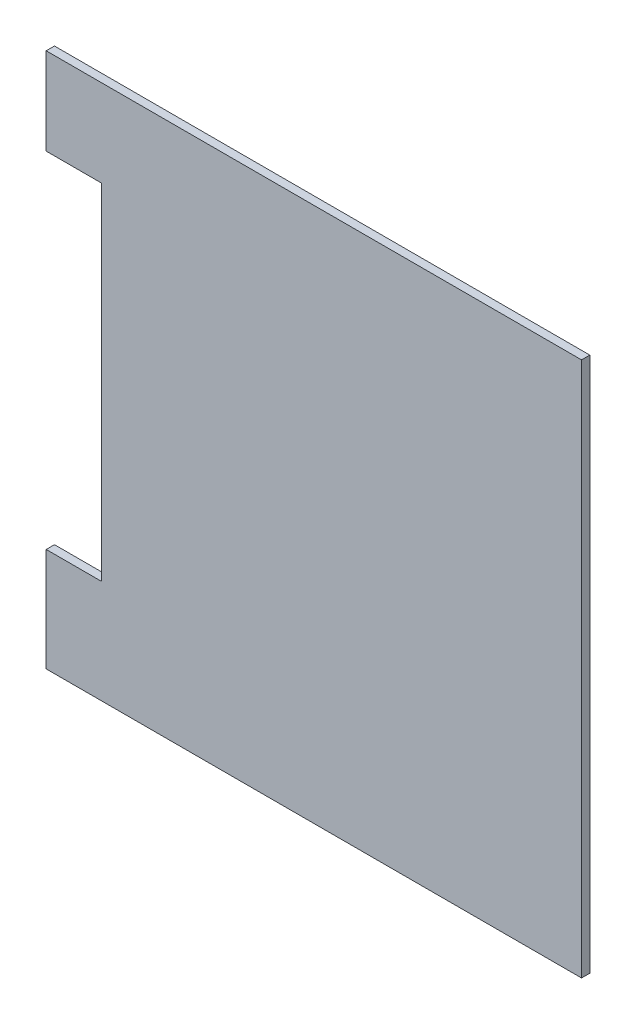
from build123d import *

# Parameters (mm, degrees)
SKETCH1_W           = 388
SKETCH1_H           = 388
BOSS_EXTRUDE1_DEPTH = 6
SKETCH2_W           = 40
SKETCH2_H           = 250
CUT_EXTRUDE1_DEPTH  = 10


with BuildPart() as part:
    # Sketch1 → Boss-Extrude1 (new body)
    with BuildSketch(Plane.XY):
        with Locations((165.428571429, 171.104761905)):
            Rectangle(SKETCH1_W, SKETCH1_H)
    extrude(amount=BOSS_EXTRUDE1_DEPTH)

    # Sketch2 → Cut-Extrude1 (cut)
    with BuildSketch(Plane.XY.offset(6)):
        with Locations((-8.571428571, 177.104761905)):
            Rectangle(SKETCH2_W, SKETCH2_H)
    extrude(amount=-CUT_EXTRUDE1_DEPTH, mode=Mode.SUBTRACT)


solid = part.part
